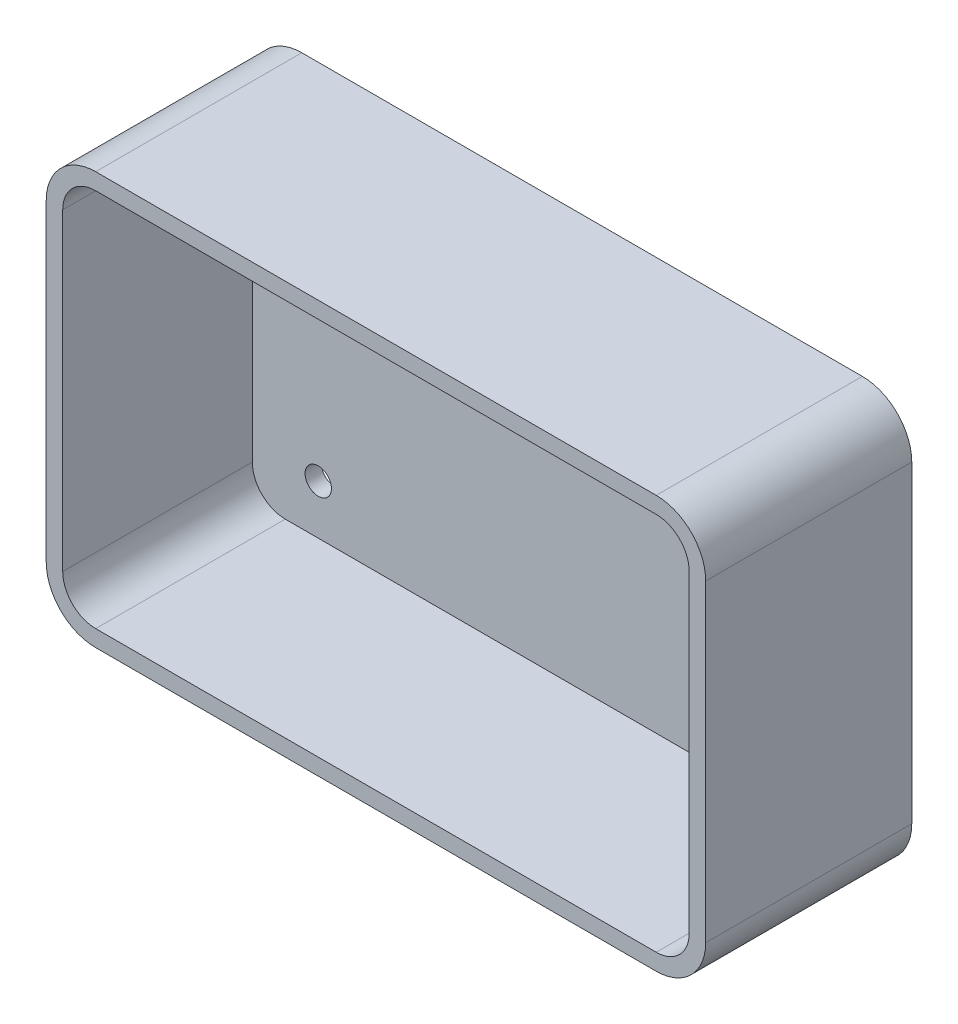
from build123d import *

# Parameters (mm, degrees)
BODY_BLOCK_DEPTH       = 25
BODY_SHELL_T           = -2
FLOOR_HOLES_DEPTH      = 54.38539126
FLOOR_HOLES_DEPTH_BACK = 54.38539126
SKETCH2_R              = 1.6


with BuildPart() as part:
    # Sketch1 → Body_Block (new body)
    with BuildSketch(Plane.XY):
        with BuildLine():
            Line((-34, -25), (34, -25))
            ThreePointArc((34, -25), (38.242640687, -23.242640687), (40, -19))
            Line((40, -19), (40, 19))
            ThreePointArc((40, 19), (38.242640687, 23.242640687), (34, 25))
            Line((34, 25), (-34, 25))
            ThreePointArc((-34, 25), (-38.242640687, 23.242640687), (-40, 19))
            Line((-40, 19), (-40, -19))
            ThreePointArc((-40, -19), (-38.242640687, -23.242640687), (-34, -25))
        make_face()
    extrude(amount=BODY_BLOCK_DEPTH)

    # Body_Shell
    body_shell_openings = [part.faces().sort_by_distance(p)[0] for p in [
        (0, 0, 25),
    ]]
    offset(amount=BODY_SHELL_T, openings=body_shell_openings, kind=Kind.INTERSECTION)

    # Sketch2 → Floor_Holes (cut, two sides: drawn at the far end of the back side and taken through both)
    with BuildSketch(Plane.XY.offset(-FLOOR_HOLES_DEPTH_BACK)):
        with Locations((-30, -17)):
            Circle(SKETCH2_R)
        with Locations((-30, 17)):
            Circle(SKETCH2_R)
        with Locations((30, -17)):
            Circle(SKETCH2_R)
        with Locations((30, 17)):
            Circle(SKETCH2_R)
    extrude(amount=FLOOR_HOLES_DEPTH + FLOOR_HOLES_DEPTH_BACK, mode=Mode.SUBTRACT)


solid = part.part
